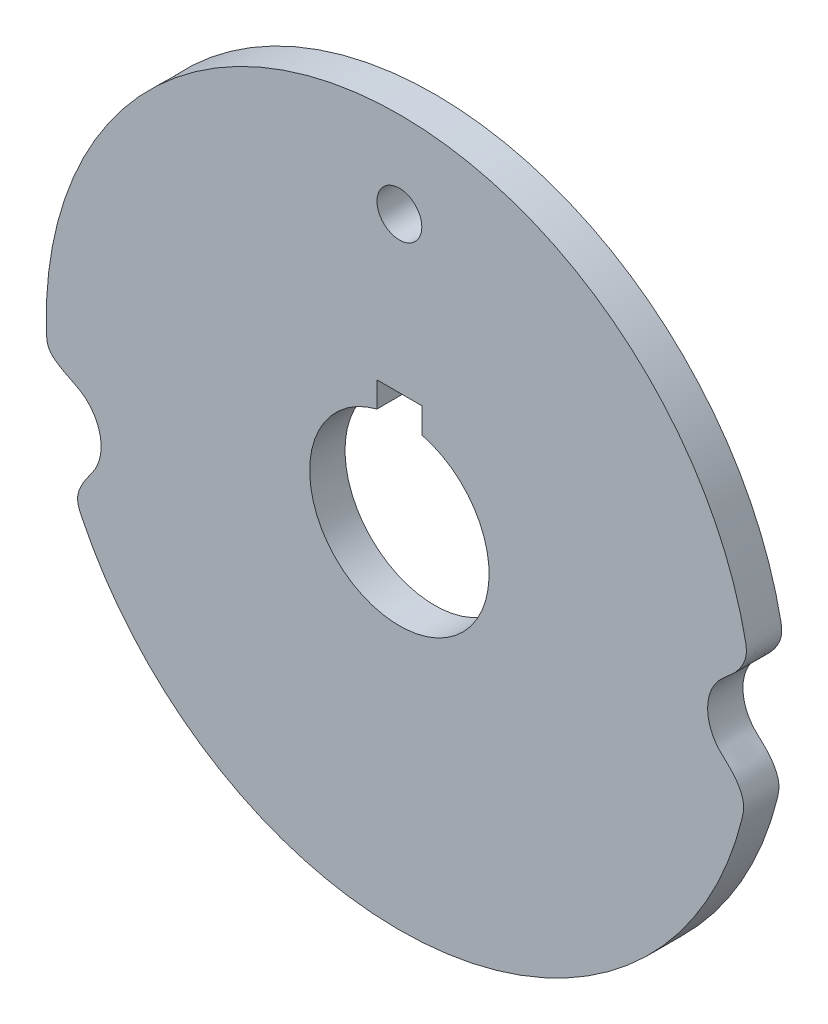
from build123d import *

# Parameters (mm, degrees)
CROQUIS1_R              = 3.175
SALIENTE_EXTRUIR1_DEPTH = 5


with BuildPart() as part:
    # Croquis1 → Saliente-Extruir1 (new body)
    with BuildSketch(Plane.XY):
        with BuildLine():
            add(Edge.make_bspline(
                [(-44.941834841, -21.914184473), (-18.152631585, -76.853757959), (36.03174388, -60.99871735), (48.446342767, -12.367371287), (48.660545035, -11.528282991), (49.045350666, -9.83897648), (47.276754361, -6.940525433), (45.853823891, -5.891425769), (45.273930912, -5.248249345), (42.906828534, -2.622826209), (42.977254722, 0.911443228), (45.447068328, 3.44048278), (46.052123514, 4.060047145), (47.515717933, 5.051628007), (49.398377327, 7.877321721), (49.081174919, 9.580616907), (48.900569873, 10.427572395), (32.050478393, 89.446834466), (-48.380404224, 81.775949082), (-49.99007616, 0.996135283), (-50.007388185, 0.127348208), (-50.002184026, -0.748327122), (-49.973419749, -1.630128394), (-49.948441869, -2.395853407), (-49.863287309, -3.926155251), (-47.185136207, -5.4928547), (-45.750400582, -6.098053489), (-45.108809654, -6.516765528), (-42.148478424, -8.448722906), (-41.311784808, -11.883248215), (-43.051862151, -14.960284313), (-43.445996248, -15.657244623), (-44.497907836, -16.902073754), (-45.960041056, -19.73827226), (-45.292761714, -21.194500035), (-44.941834841, -21.914184473)],
                knots=[0, 0, 0, 0, 0.349446212, 0.349446212, 0.349446212, 0.360869056, 0.3722919, 0.383714744, 0.383714744, 0.383714744, 0.421924911, 0.421924911, 0.421924911, 0.433347754, 0.444770598, 0.456193442, 0.456193442, 0.456193442, 0.89296842, 0.89296842, 0.89296842, 0.904255529, 0.904255529, 0.904255529, 0.9139107, 0.923565871, 0.933221043, 0.933221043, 0.933221043, 0.969728162, 0.969728162, 0.969728162, 0.979818775, 0.989909387, 1, 1, 1, 1], degree=3, weights=[0.716785543, 0.43342931, 0.527834129, 1, 1, 1, 1, 1, 1, 0.819474602, 0.819474602, 1, 1, 1, 1, 1, 1, 0.409836963, 0.409836963, 1, 0.984749048, 0.96989221, 0.955429486, 0.955429486, 0.955429486, 0.955429486, 0.955429486, 0.955429486, 0.782950198, 0.782950198, 0.955429486, 0.955429486, 0.955429486, 0.955429486, 0.955429486, 0.716785543]))
        make_face()
        with Locations((0, 37.79)):
            Circle(CROQUIS1_R, mode=Mode.SUBTRACT)
        with BuildLine():
            Line((3.175, 12.296722124), (3.175, 15.875))
            Line((3.175, 15.875), (-3.175, 15.875))
            Line((-3.175, 15.875), (-3.175, 12.296722124))
            ThreePointArc((-3.175, 12.296722124), (0, -12.7), (3.175, 12.296722124))
        make_face(mode=Mode.SUBTRACT)
    extrude(amount=SALIENTE_EXTRUIR1_DEPTH)


solid = part.part
